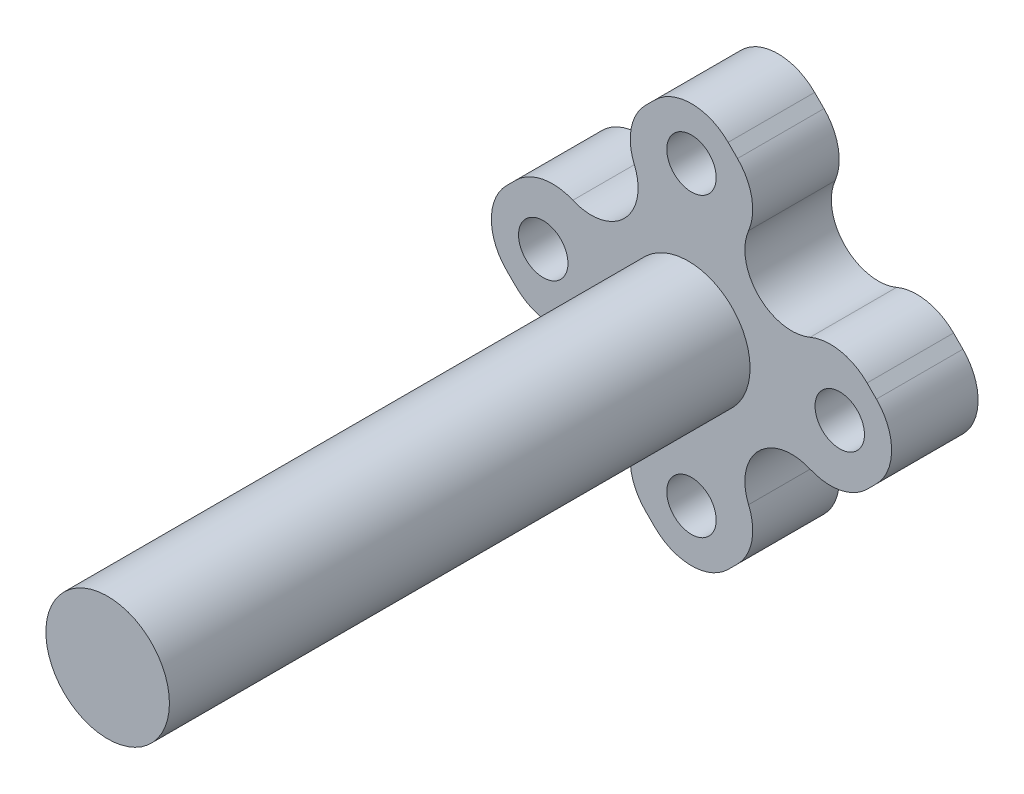
from build123d import *

# Parameters (mm, degrees)
EXTRUDE_1_DEPTH = 3.5
SKETCH_3_R      = 2.5
EXTRUDE_2_DEPTH = 23.5


with BuildPart() as part:
    # 草图1 → 凸台-拉伸1 (new body)
    with BuildSketch(Plane.XY):
        with BuildLine():
            Line((-1.734039986, 7.089233915), (-1.356062107, 7.467211795))
            ThreePointArc((-1.356062107, 7.467211795), (0.128862134, 8.082287554), (1.613786374, 7.467211795))
            Line((1.613786374, 7.467211795), (1.991764254, 7.089233915))
            ThreePointArc((1.991764254, 7.089233915), (2.446987032, 6.407944883), (2.606840013, 5.604309675))
            ThreePointArc((2.606840013, 5.604309675), (2.564770676, 5.186073633), (2.440248217, 4.784594652))
            ThreePointArc((2.440248217, 4.784594652), (2.846019421, 2.699444842), (4.931169231, 2.293673637))
            ThreePointArc((4.931169231, 2.293673637), (6.152020505, 2.421597457), (7.235808495, 1.845189674))
            Line((7.235808495, 1.845189674), (7.613786374, 1.467211795))
            ThreePointArc((7.613786374, 1.467211795), (8.069009152, 0.785922762), (8.228862134, -0.017712446))
            ThreePointArc((8.228862134, -0.017712446), (8.069009152, -0.821347654), (7.613786374, -1.502636686))
            Line((7.613786374, -1.502636686), (7.235808495, -1.880614566))
            ThreePointArc((7.235808495, -1.880614566), (6.152020505, -2.457022348), (4.931169231, -2.329098529))
            ThreePointArc((4.931169231, -2.329098529), (2.846019421, -2.734869733), (2.440248217, -4.820019543))
            ThreePointArc((2.440248217, -4.820019543), (2.564770676, -5.221498525), (2.606840013, -5.639734566))
            ThreePointArc((2.606840013, -5.639734566), (2.446987032, -6.443369774), (1.991764254, -7.124658807))
            Line((1.991764254, -7.124658807), (1.613786374, -7.502636686))
            ThreePointArc((1.613786374, -7.502636686), (0.128862134, -8.117712446), (-1.356062107, -7.502636686))
            Line((-1.356062107, -7.502636686), (-1.734039986, -7.124658807))
            ThreePointArc((-1.734039986, -7.124658807), (-2.310447768, -6.040870817), (-2.182523949, -4.820019543))
            ThreePointArc((-2.182523949, -4.820019543), (-2.069860771, -4.456776655), (-2.031798038, -4.078372618))
            ThreePointArc((-2.031798038, -4.078372618), (-2.882781632, -2.494212089), (-4.673444964, -2.329098529))
            ThreePointArc((-4.673444964, -2.329098529), (-5.894296238, -2.457022348), (-6.978084227, -1.880614566))
            Line((-6.978084227, -1.880614566), (-7.356062107, -1.502636686))
            ThreePointArc((-7.356062107, -1.502636686), (-7.971137866, -0.017712446), (-7.356062107, 1.467211795))
            Line((-7.356062107, 1.467211795), (-6.978084227, 1.845189674))
            ThreePointArc((-6.978084227, 1.845189674), (-5.894296238, 2.421597457), (-4.673444964, 2.293673637))
            ThreePointArc((-4.673444964, 2.293673637), (-2.882781632, 2.458787198), (-2.031798038, 4.042947726))
            ThreePointArc((-2.031798038, 4.042947726), (-2.069860771, 4.421351764), (-2.182523949, 4.784594652))
            ThreePointArc((-2.182523949, 4.784594652), (-2.310447768, 6.005445926), (-1.734039986, 7.089233915))
        make_face()
        with BuildLine():
            ThreePointArc((-0.871137866, 5.982287554), (0.128862134, 4.982287554), (1.128862134, 5.982287554))
            ThreePointArc((1.128862134, 5.982287554), (0.128862134, 6.982287554), (-0.871137866, 5.982287554))
        make_face(mode=Mode.SUBTRACT)
        with BuildLine():
            ThreePointArc((-0.871137866, -6.017712446), (0.128862134, -7.017712446), (1.128862134, -6.017712446))
            ThreePointArc((1.128862134, -6.017712446), (0.128862134, -5.017712446), (-0.871137866, -6.017712446))
        make_face(mode=Mode.SUBTRACT)
        with BuildLine():
            ThreePointArc((5.128862134, -0.017712446), (6.128862134, -1.017712446), (7.128862134, -0.017712446))
            ThreePointArc((7.128862134, -0.017712446), (6.128862134, 0.982287554), (5.128862134, -0.017712446))
        make_face(mode=Mode.SUBTRACT)
        with BuildLine():
            ThreePointArc((-6.871137866, -0.017712446), (-5.871137866, -1.017712446), (-4.871137866, -0.017712446))
            ThreePointArc((-4.871137866, -0.017712446), (-5.871137866, 0.982287554), (-6.871137866, -0.017712446))
        make_face(mode=Mode.SUBTRACT)
    extrude(amount=EXTRUDE_1_DEPTH)

    # 草图3 → 凸台-拉伸2 (add)
    with BuildSketch(Plane.XY.offset(3.5)):
        Circle(SKETCH_3_R)
    extrude(amount=EXTRUDE_2_DEPTH)


solid = part.part
